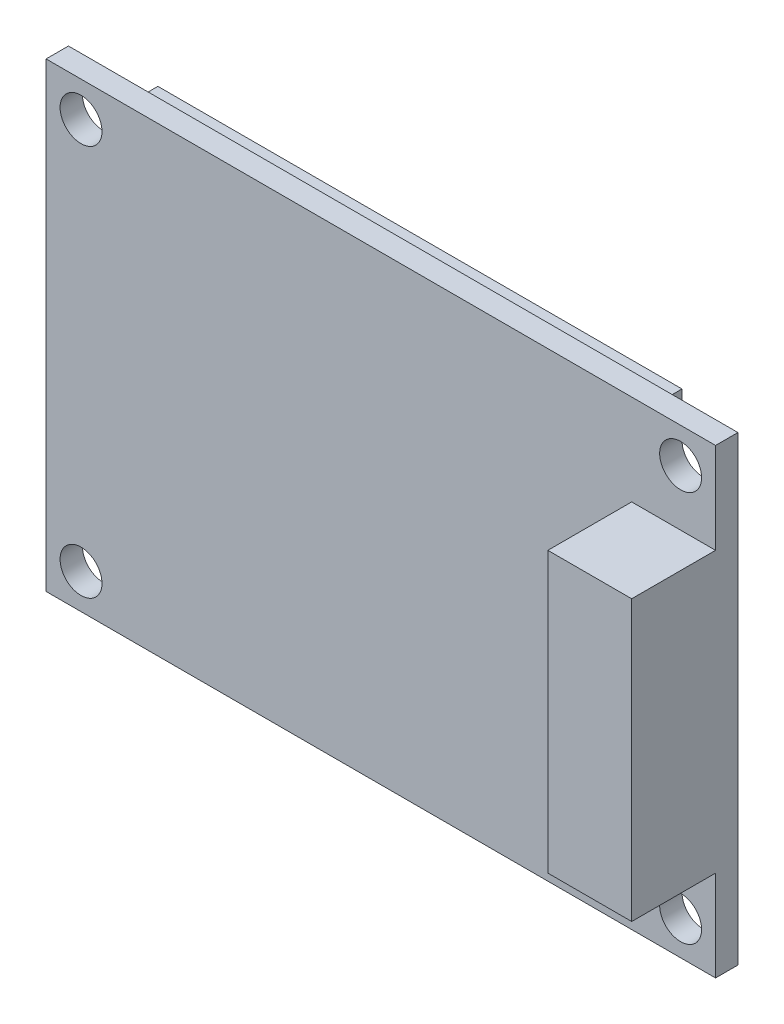
from build123d import *

# Parameters (mm, degrees)
BASE_PCB_2_W              = 47.9
BASE_PCB_2_H              = 33
BASE_PCB_2_R              = 1.5
BASE_PCB_DEPTH            = 1.6
ESQUISSE4_W               = 37.5
ESQUISSE4_H               = 32
E_INK_DISPLAY_DEPTH       = 1.2
ESQUISSE5_W               = 27.6
ESQUISSE5_H               = 27.6
DISPLAY_200_200_DEPTH     = 0.5
ESQUISSE6_W               = 6
ESQUISSE6_H               = 20
CONNECTEUR_8BROCHES_DEPTH = 6


with BuildPart() as part:
    # BASE PCB 2 → Base_PCB (new body)
    with BuildSketch(Plane.XY):
        Rectangle(BASE_PCB_2_W, BASE_PCB_2_H)
        with Locations((-21.45, 14)):
            Circle(BASE_PCB_2_R, mode=Mode.SUBTRACT)
        with Locations((-21.45, -14)):
            Circle(BASE_PCB_2_R, mode=Mode.SUBTRACT)
        with Locations(Location((21.45, -14, 0), (0, 0, 180))):
            Circle(BASE_PCB_2_R, mode=Mode.SUBTRACT)
        with Locations(Location((21.45, 14, 0), (0, 0, 180))):
            Circle(BASE_PCB_2_R, mode=Mode.SUBTRACT)
    extrude(amount=BASE_PCB_DEPTH)

    # Esquisse4 → E-Ink_display (add)
    with BuildSketch(Plane.XY):
        Rectangle(ESQUISSE4_W, ESQUISSE4_H)
    extrude(amount=-E_INK_DISPLAY_DEPTH)

    # Esquisse5 → Display_200*200 (cut)
    with BuildSketch(Plane(origin=(0, 0, -1.2), x_dir=(-1, 0, 0), z_dir=(0, 0, -1))):
        with Locations((-2.95, 0)):
            Rectangle(ESQUISSE5_W, ESQUISSE5_H)
    extrude(amount=-DISPLAY_200_200_DEPTH, mode=Mode.SUBTRACT)

    # Esquisse6 → Connecteur_8broches (add)
    with BuildSketch(Plane.XY.offset(1.6)):
        with Locations((20.95, 0)):
            Rectangle(ESQUISSE6_W, ESQUISSE6_H)
    extrude(amount=CONNECTEUR_8BROCHES_DEPTH)


solid = part.part
